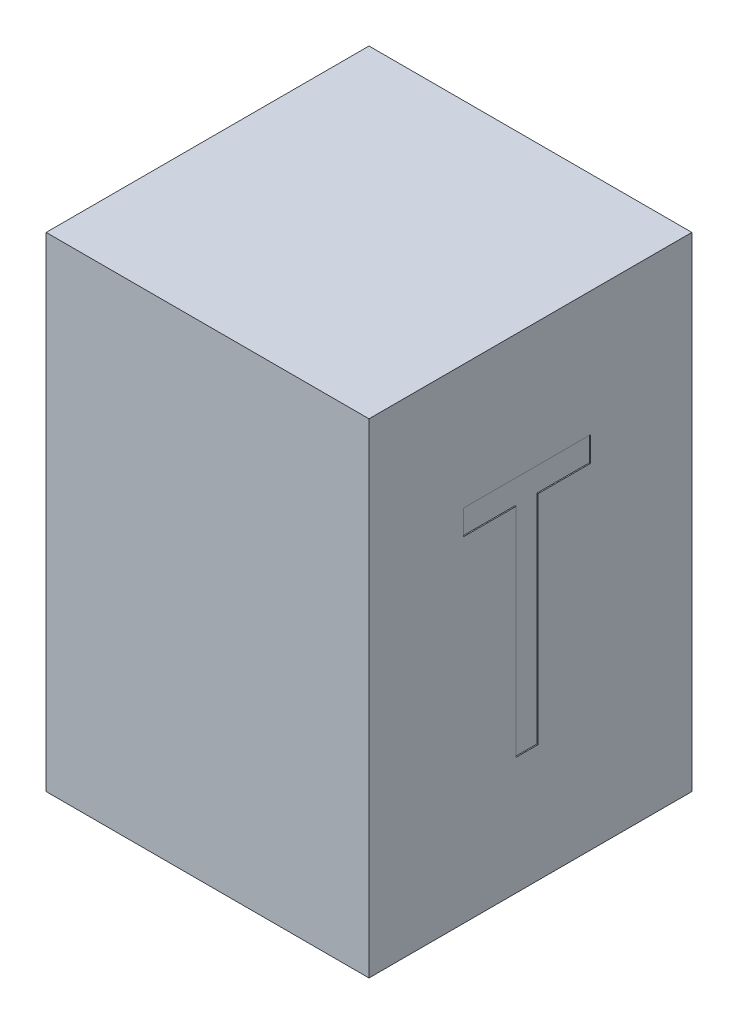
from build123d import *

# Parameters (mm, degrees)
SKETCH1_W           = 76.2
SKETCH1_H           = 76.2
BOSS_EXTRUDE1_DEPTH = 114.3
CUT_EXTRUDE1_DEPTH  = 0.254


with BuildPart() as part:
    # Sketch1 → Boss-Extrude1 (new body)
    with BuildSketch(Plane(origin=(0, 0, 0), x_dir=(1, 0, 0), z_dir=(0, 1, 0))):
        with Locations((38.1, -38.1)):
            Rectangle(SKETCH1_W, SKETCH1_H)
    extrude(amount=BOSS_EXTRUDE1_DEPTH)

    # Sketch2 → Cut-Extrude1 (cut)
    with BuildSketch(Plane(origin=(76.2, 0, 0), x_dir=(0, 0, -1), z_dir=(1, 0, 0))):
        Polygon((-53.917987266, 79.041302106), (-53.917987266, 84.902840567), (-23.87760265, 84.902840567), (-23.87760265, 79.041302106), (-36.333371881, 79.041302106), (-36.333371881, 27.752840567), (-41.462218035, 27.752840567), (-41.462218035, 79.041302106), align=None)
    extrude(amount=-CUT_EXTRUDE1_DEPTH, mode=Mode.SUBTRACT)


solid = part.part
